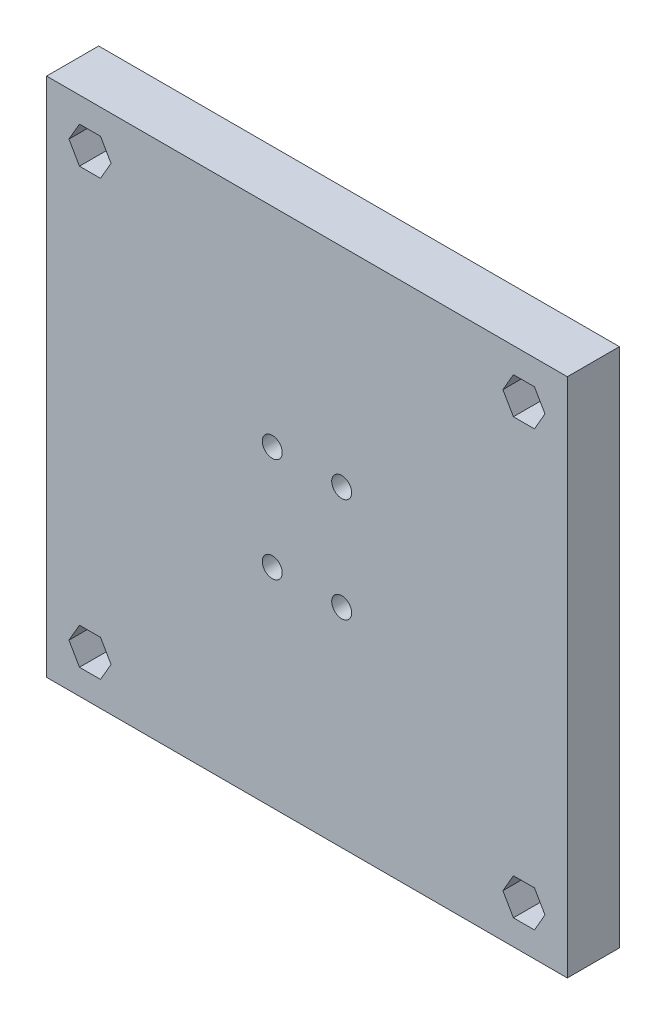
from build123d import *

# Parameters (mm, degrees)
SKETCH1_W           = 60
SKETCH1_H           = 60
BOSS_EXTRUDE1_DEPTH = 6
SKETCH2_R           = 1.15
CUT_EXTRUDE1_DEPTH  = 43.848570571
SKETCH3_R           = 1.15
CUT_EXTRUDE2_DEPTH  = 4
CUT_EXTRUDE3_DEPTH  = 3
SKETCH5_R           = 1.15
CUT_EXTRUDE4_DEPTH  = 43.532340636


with BuildPart() as part:
    # Sketch1 → Boss-Extrude1 (new body)
    with BuildSketch(Plane.XY):
        Rectangle(SKETCH1_W, SKETCH1_H)
    extrude(amount=BOSS_EXTRUDE1_DEPTH)

    # Sketch2 → Cut-Extrude1 (cut, through all)
    with BuildSketch(Plane.XY.offset(6)):
        with BuildLine():
            ThreePointArc((-25, 26.15), (-26.15, 25), (-25, 23.85))
            Line((-25, 23.85), (-25, 26.15))
        make_face()
        with BuildLine():
            Line((-25, 26.15), (-25, 23.85))
            ThreePointArc((-25, 23.85), (-24.186827202, 24.186827202), (-23.85, 25))
            ThreePointArc((-23.85, 25), (-24.186827202, 25.813172798), (-25, 26.15))
        make_face()
        with Locations((25, 25)):
            Circle(SKETCH2_R)
        with Locations((25, -25)):
            Circle(SKETCH2_R)
        with Locations((-25, -25)):
            Circle(SKETCH2_R)
    extrude(amount=-CUT_EXTRUDE1_DEPTH, mode=Mode.SUBTRACT)

    # Sketch3 → Cut-Extrude2 (cut)
    # profile 1 of 4: a face of its own
    with BuildSketch(Plane.XY.offset(6)):
        Polygon((-26.212435565, 22.9), (-23.787564435, 22.9), (-22.575128869, 25), (-23.787564435, 27.1), (-26.212435565, 27.1), (-27.424871131, 25), align=None)
        with Locations((-25, 25)):
            Circle(SKETCH3_R, mode=Mode.SUBTRACT)
    # profile 2 of 4: a face of its own
    with BuildSketch(Plane.XY.offset(6)):
        Polygon((22.575128869, 25), (23.787564435, 27.1), (26.212435565, 27.1), (27.424871131, 25), (26.212435565, 22.9), (23.787564435, 22.9), align=None)
        with Locations((25, 25)):
            Circle(SKETCH3_R, mode=Mode.SUBTRACT)
    # profile 3 of 4: a face of its own
    with BuildSketch(Plane.XY.offset(6)):
        Polygon((26.212435565, -22.9), (23.787564435, -22.9), (22.575128869, -25), (23.787564435, -27.1), (26.212435565, -27.1), (27.424871131, -25), align=None)
        with Locations((25, -25)):
            Circle(SKETCH3_R, mode=Mode.SUBTRACT)
    # profile 4 of 4: a face of its own
    with BuildSketch(Plane.XY.offset(6)):
        Polygon((-22.575128869, -25), (-23.787564435, -27.1), (-26.212435565, -27.1), (-27.424871131, -25), (-26.212435565, -22.9), (-23.787564435, -22.9), align=None)
        with Locations((-25, -25)):
            Circle(SKETCH3_R, mode=Mode.SUBTRACT)
    extrude(amount=-CUT_EXTRUDE2_DEPTH, mode=Mode.SUBTRACT)

    # Sketch4 → Cut-Extrude3 (cut)
    with BuildSketch(Plane(origin=(0, 0, 0), x_dir=(-1, 0, 0), z_dir=(0, 0, -1))):
        with BuildLine():
            ThreePointArc((-4, 3.9), (-2.51507576, 4.51507576), (-1.9, 6))
            Line((-1.9, 6), (-4, 6))
            Line((-4, 6), (-4, 3.9))
        make_face()
        with BuildLine():
            Line((-4, 6), (-1.9, 6))
            ThreePointArc((-1.9, 6), (-5.48492424, 7.48492424), (-4, 3.9))
            Line((-4, 3.9), (-4, 6))
        make_face()
        with BuildLine():
            ThreePointArc((6.1, 6), (4, 8.1), (1.9, 6))
            Line((1.9, 6), (4, 6))
            Line((4, 6), (4, 3.9))
            ThreePointArc((4, 3.9), (5.48492424, 4.51507576), (6.1, 6))
        make_face()
        with BuildLine():
            Line((4, 6), (1.9, 6))
            ThreePointArc((1.9, 6), (2.51507576, 4.51507576), (4, 3.9))
            Line((4, 3.9), (4, 6))
        make_face()
        with BuildLine():
            ThreePointArc((4, -3.9), (2.51507576, -4.51507576), (1.9, -6))
            Line((1.9, -6), (4, -6))
            Line((4, -6), (4, -3.9))
        make_face()
        with BuildLine():
            Line((4, -6), (1.9, -6))
            ThreePointArc((1.9, -6), (4, -8.1), (6.1, -6))
            ThreePointArc((6.1, -6), (5.48492424, -4.51507576), (4, -3.9))
            Line((4, -3.9), (4, -6))
        make_face()
        with BuildLine():
            ThreePointArc((-4, -3.9), (-5.48492424, -7.48492424), (-1.9, -6))
            Line((-1.9, -6), (-4, -6))
            Line((-4, -6), (-4, -3.9))
        make_face()
        with BuildLine():
            Line((-4, -6), (-1.9, -6))
            ThreePointArc((-1.9, -6), (-2.51507576, -4.51507576), (-4, -3.9))
            Line((-4, -3.9), (-4, -6))
        make_face()
    extrude(amount=-CUT_EXTRUDE3_DEPTH, mode=Mode.SUBTRACT)

    # Sketch5 → Cut-Extrude4 (cut, through all)
    with BuildSketch(Plane(origin=(0, 0, 3), x_dir=(-1, 0, 0), z_dir=(0, 0, -1))):
        with Locations((-4, 6)):
            Circle(SKETCH5_R)
        with Locations((4, 6)):
            Circle(SKETCH5_R)
        with Locations((4, -6)):
            Circle(SKETCH5_R)
        with Locations((-4, -6)):
            Circle(SKETCH5_R)
    extrude(amount=-CUT_EXTRUDE4_DEPTH, mode=Mode.SUBTRACT)


solid = part.part
